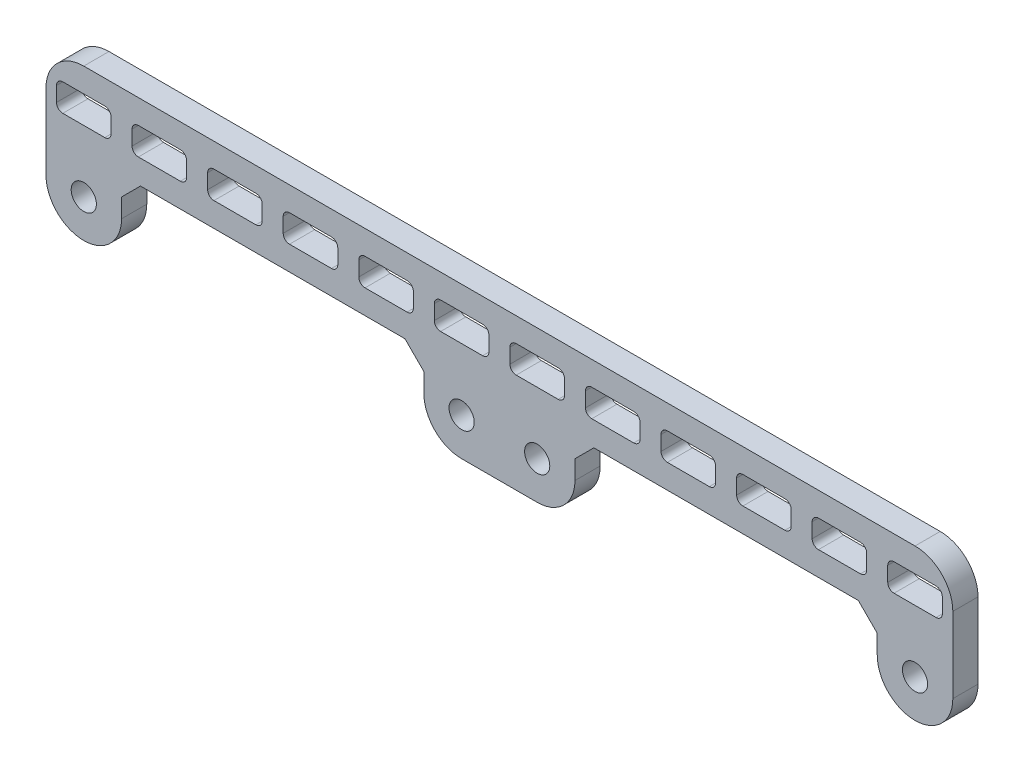
from build123d import *

# Parameters (mm, degrees)
MODEL_R                 = 1.5
SALIENTE_EXTRUIR1_DEPTH = 3


with BuildPart() as part:
    # Model → Saliente-Extruir1 (new body)
    with BuildSketch(Plane.XY):
        with BuildLine():
            Line((256.429131311, 228.742243614), (355.429131311, 228.742243614))
            ThreePointArc((355.429131311, 228.742243614), (358.611111826, 227.424224129), (359.929131311, 224.242243614))
            Line((359.929131311, 224.242243614), (359.929131311, 215.242243614))
            ThreePointArc((359.929131311, 215.242243614), (355.429131311, 210.742243614), (350.929131311, 215.242243614))
            Line((350.929131311, 215.242243614), (350.929131311, 217.492243614))
            Line((350.929131311, 217.492243614), (348.679131311, 219.742243614))
            Line((348.679131311, 219.742243614), (317.179131311, 219.742243614))
            Line((317.179131311, 219.742243614), (314.929131311, 217.492243614))
            Line((314.929131311, 217.492243614), (314.929131311, 215.242243614))
            ThreePointArc((314.929131311, 215.242243614), (313.611111826, 212.060263099), (310.429131311, 210.742243614))
            Line((310.429131311, 210.742243614), (301.429131311, 210.742243614))
            ThreePointArc((301.429131311, 210.742243614), (298.247150795, 212.060263099), (296.929131311, 215.242243614))
            Line((296.929131311, 215.242243614), (296.929131311, 217.492243614))
            Line((296.929131311, 217.492243614), (294.679131311, 219.742243614))
            Line((294.679131311, 219.742243614), (263.179131311, 219.742243614))
            Line((263.179131311, 219.742243614), (260.929131311, 217.492243614))
            Line((260.929131311, 217.492243614), (260.929131311, 215.242243614))
            ThreePointArc((260.929131311, 215.242243614), (256.429131311, 210.742243614), (251.929131311, 215.242243614))
            Line((251.929131311, 215.242243614), (251.929131311, 224.242243614))
            ThreePointArc((251.929131311, 224.242243614), (253.247150795, 227.424224129), (256.429131311, 228.742243614))
        make_face()
        with Locations((301.429131311, 215.242243614)):
            Circle(MODEL_R, mode=Mode.SUBTRACT)
        with Locations((355.429131311, 215.242243614)):
            Circle(MODEL_R, mode=Mode.SUBTRACT)
        with Locations((256.429131311, 215.242243614)):
            Circle(MODEL_R, mode=Mode.SUBTRACT)
        with Locations((310.429131311, 215.242243614)):
            Circle(MODEL_R, mode=Mode.SUBTRACT)
        with BuildLine():
            Line((321.929131311, 222.617243614), (316.929131311, 222.617243614))
            ThreePointArc((316.929131311, 222.617243614), (316.398801225, 222.836913528), (316.179131311, 223.367243614))
            Line((316.179131311, 223.367243614), (316.179131311, 225.117243614))
            ThreePointArc((316.179131311, 225.117243614), (316.398801225, 225.6475737), (316.929131311, 225.867243614))
            Line((316.929131311, 225.867243614), (321.929131311, 225.867243614))
            ThreePointArc((321.929131311, 225.867243614), (322.459461397, 225.6475737), (322.679131311, 225.117243614))
            Line((322.679131311, 225.117243614), (322.679131311, 223.367243614))
            ThreePointArc((322.679131311, 223.367243614), (322.459461397, 222.836913528), (321.929131311, 222.617243614))
        make_face(mode=Mode.SUBTRACT)
        with BuildLine():
            Line((357.929131311, 222.617243614), (352.929131311, 222.617243614))
            ThreePointArc((352.929131311, 222.617243614), (352.398801225, 222.836913528), (352.179131311, 223.367243614))
            Line((352.179131311, 223.367243614), (352.179131311, 225.117243614))
            ThreePointArc((352.179131311, 225.117243614), (352.398801225, 225.6475737), (352.929131311, 225.867243614))
            Line((352.929131311, 225.867243614), (357.929131311, 225.867243614))
            ThreePointArc((357.929131311, 225.867243614), (358.459461397, 225.6475737), (358.679131311, 225.117243614))
            Line((358.679131311, 225.117243614), (358.679131311, 223.367243614))
            ThreePointArc((358.679131311, 223.367243614), (358.459461397, 222.836913528), (357.929131311, 222.617243614))
        make_face(mode=Mode.SUBTRACT)
        with BuildLine():
            Line((348.929131311, 222.617243614), (343.929131311, 222.617243614))
            ThreePointArc((343.929131311, 222.617243614), (343.398801225, 222.836913528), (343.179131311, 223.367243614))
            Line((343.179131311, 223.367243614), (343.179131311, 225.117243614))
            ThreePointArc((343.179131311, 225.117243614), (343.398801225, 225.6475737), (343.929131311, 225.867243614))
            Line((343.929131311, 225.867243614), (348.929131311, 225.867243614))
            ThreePointArc((348.929131311, 225.867243614), (349.459461397, 225.6475737), (349.679131311, 225.117243614))
            Line((349.679131311, 225.117243614), (349.679131311, 223.367243614))
            ThreePointArc((349.679131311, 223.367243614), (349.459461397, 222.836913528), (348.929131311, 222.617243614))
        make_face(mode=Mode.SUBTRACT)
        with BuildLine():
            Line((339.929131311, 222.617243614), (334.929131311, 222.617243614))
            ThreePointArc((334.929131311, 222.617243614), (334.398801225, 222.836913528), (334.179131311, 223.367243614))
            Line((334.179131311, 223.367243614), (334.179131311, 225.117243614))
            ThreePointArc((334.179131311, 225.117243614), (334.398801225, 225.6475737), (334.929131311, 225.867243614))
            Line((334.929131311, 225.867243614), (339.929131311, 225.867243614))
            ThreePointArc((339.929131311, 225.867243614), (340.459461397, 225.6475737), (340.679131311, 225.117243614))
            Line((340.679131311, 225.117243614), (340.679131311, 223.367243614))
            ThreePointArc((340.679131311, 223.367243614), (340.459461397, 222.836913528), (339.929131311, 222.617243614))
        make_face(mode=Mode.SUBTRACT)
        with BuildLine():
            Line((330.929131311, 222.617243614), (325.929131311, 222.617243614))
            ThreePointArc((325.929131311, 222.617243614), (325.398801225, 222.836913528), (325.179131311, 223.367243614))
            Line((325.179131311, 223.367243614), (325.179131311, 225.117243614))
            ThreePointArc((325.179131311, 225.117243614), (325.398801225, 225.6475737), (325.929131311, 225.867243614))
            Line((325.929131311, 225.867243614), (330.929131311, 225.867243614))
            ThreePointArc((330.929131311, 225.867243614), (331.459461397, 225.6475737), (331.679131311, 225.117243614))
            Line((331.679131311, 225.117243614), (331.679131311, 223.367243614))
            ThreePointArc((331.679131311, 223.367243614), (331.459461397, 222.836913528), (330.929131311, 222.617243614))
        make_face(mode=Mode.SUBTRACT)
        with BuildLine():
            Line((289.929131311, 222.617243614), (294.929131311, 222.617243614))
            ThreePointArc((294.929131311, 222.617243614), (295.459461397, 222.836913528), (295.679131311, 223.367243614))
            Line((295.679131311, 223.367243614), (295.679131311, 225.117243614))
            ThreePointArc((295.679131311, 225.117243614), (295.459461397, 225.6475737), (294.929131311, 225.867243614))
            Line((294.929131311, 225.867243614), (289.929131311, 225.867243614))
            ThreePointArc((289.929131311, 225.867243614), (289.398801225, 225.6475737), (289.179131311, 225.117243614))
            Line((289.179131311, 225.117243614), (289.179131311, 223.367243614))
            ThreePointArc((289.179131311, 223.367243614), (289.398801225, 222.836913528), (289.929131311, 222.617243614))
        make_face(mode=Mode.SUBTRACT)
        with BuildLine():
            Line((253.929131311, 222.617243614), (258.929131311, 222.617243614))
            ThreePointArc((258.929131311, 222.617243614), (259.459461397, 222.836913528), (259.679131311, 223.367243614))
            Line((259.679131311, 223.367243614), (259.679131311, 225.117243614))
            ThreePointArc((259.679131311, 225.117243614), (259.459461397, 225.6475737), (258.929131311, 225.867243614))
            Line((258.929131311, 225.867243614), (253.929131311, 225.867243614))
            ThreePointArc((253.929131311, 225.867243614), (253.398801225, 225.6475737), (253.179131311, 225.117243614))
            Line((253.179131311, 225.117243614), (253.179131311, 223.367243614))
            ThreePointArc((253.179131311, 223.367243614), (253.398801225, 222.836913528), (253.929131311, 222.617243614))
        make_face(mode=Mode.SUBTRACT)
        with BuildLine():
            Line((262.929131311, 222.617243614), (267.929131311, 222.617243614))
            ThreePointArc((267.929131311, 222.617243614), (268.459461397, 222.836913528), (268.679131311, 223.367243614))
            Line((268.679131311, 223.367243614), (268.679131311, 225.117243614))
            ThreePointArc((268.679131311, 225.117243614), (268.459461397, 225.6475737), (267.929131311, 225.867243614))
            Line((267.929131311, 225.867243614), (262.929131311, 225.867243614))
            ThreePointArc((262.929131311, 225.867243614), (262.398801225, 225.6475737), (262.179131311, 225.117243614))
            Line((262.179131311, 225.117243614), (262.179131311, 223.367243614))
            ThreePointArc((262.179131311, 223.367243614), (262.398801225, 222.836913528), (262.929131311, 222.617243614))
        make_face(mode=Mode.SUBTRACT)
        with BuildLine():
            Line((271.929131311, 222.617243614), (276.929131311, 222.617243614))
            ThreePointArc((276.929131311, 222.617243614), (277.459461397, 222.836913528), (277.679131311, 223.367243614))
            Line((277.679131311, 223.367243614), (277.679131311, 225.117243614))
            ThreePointArc((277.679131311, 225.117243614), (277.459461397, 225.6475737), (276.929131311, 225.867243614))
            Line((276.929131311, 225.867243614), (271.929131311, 225.867243614))
            ThreePointArc((271.929131311, 225.867243614), (271.398801225, 225.6475737), (271.179131311, 225.117243614))
            Line((271.179131311, 225.117243614), (271.179131311, 223.367243614))
            ThreePointArc((271.179131311, 223.367243614), (271.398801225, 222.836913528), (271.929131311, 222.617243614))
        make_face(mode=Mode.SUBTRACT)
        with BuildLine():
            Line((280.929131311, 222.617243614), (285.929131311, 222.617243614))
            ThreePointArc((285.929131311, 222.617243614), (286.459461397, 222.836913528), (286.679131311, 223.367243614))
            Line((286.679131311, 223.367243614), (286.679131311, 225.117243614))
            ThreePointArc((286.679131311, 225.117243614), (286.459461397, 225.6475737), (285.929131311, 225.867243614))
            Line((285.929131311, 225.867243614), (280.929131311, 225.867243614))
            ThreePointArc((280.929131311, 225.867243614), (280.398801225, 225.6475737), (280.179131311, 225.117243614))
            Line((280.179131311, 225.117243614), (280.179131311, 223.367243614))
            ThreePointArc((280.179131311, 223.367243614), (280.398801225, 222.836913528), (280.929131311, 222.617243614))
        make_face(mode=Mode.SUBTRACT)
        with BuildLine():
            Line((307.929131311, 222.617243614), (312.929131311, 222.617243614))
            ThreePointArc((312.929131311, 222.617243614), (313.459461397, 222.836913528), (313.679131311, 223.367243614))
            Line((313.679131311, 223.367243614), (313.679131311, 225.117243614))
            ThreePointArc((313.679131311, 225.117243614), (313.459461397, 225.6475737), (312.929131311, 225.867243614))
            Line((312.929131311, 225.867243614), (307.929131311, 225.867243614))
            ThreePointArc((307.929131311, 225.867243614), (307.398801225, 225.6475737), (307.179131311, 225.117243614))
            Line((307.179131311, 225.117243614), (307.179131311, 223.367243614))
            ThreePointArc((307.179131311, 223.367243614), (307.398801225, 222.836913528), (307.929131311, 222.617243614))
        make_face(mode=Mode.SUBTRACT)
        with BuildLine():
            Line((298.929131311, 222.617243614), (303.929131311, 222.617243614))
            ThreePointArc((303.929131311, 222.617243614), (304.459461397, 222.836913528), (304.679131311, 223.367243614))
            Line((304.679131311, 223.367243614), (304.679131311, 225.117243614))
            ThreePointArc((304.679131311, 225.117243614), (304.459461397, 225.6475737), (303.929131311, 225.867243614))
            Line((303.929131311, 225.867243614), (298.929131311, 225.867243614))
            ThreePointArc((298.929131311, 225.867243614), (298.398801225, 225.6475737), (298.179131311, 225.117243614))
            Line((298.179131311, 225.117243614), (298.179131311, 223.367243614))
            ThreePointArc((298.179131311, 223.367243614), (298.398801225, 222.836913528), (298.929131311, 222.617243614))
        make_face(mode=Mode.SUBTRACT)
    extrude(amount=SALIENTE_EXTRUIR1_DEPTH)


solid = part.part
